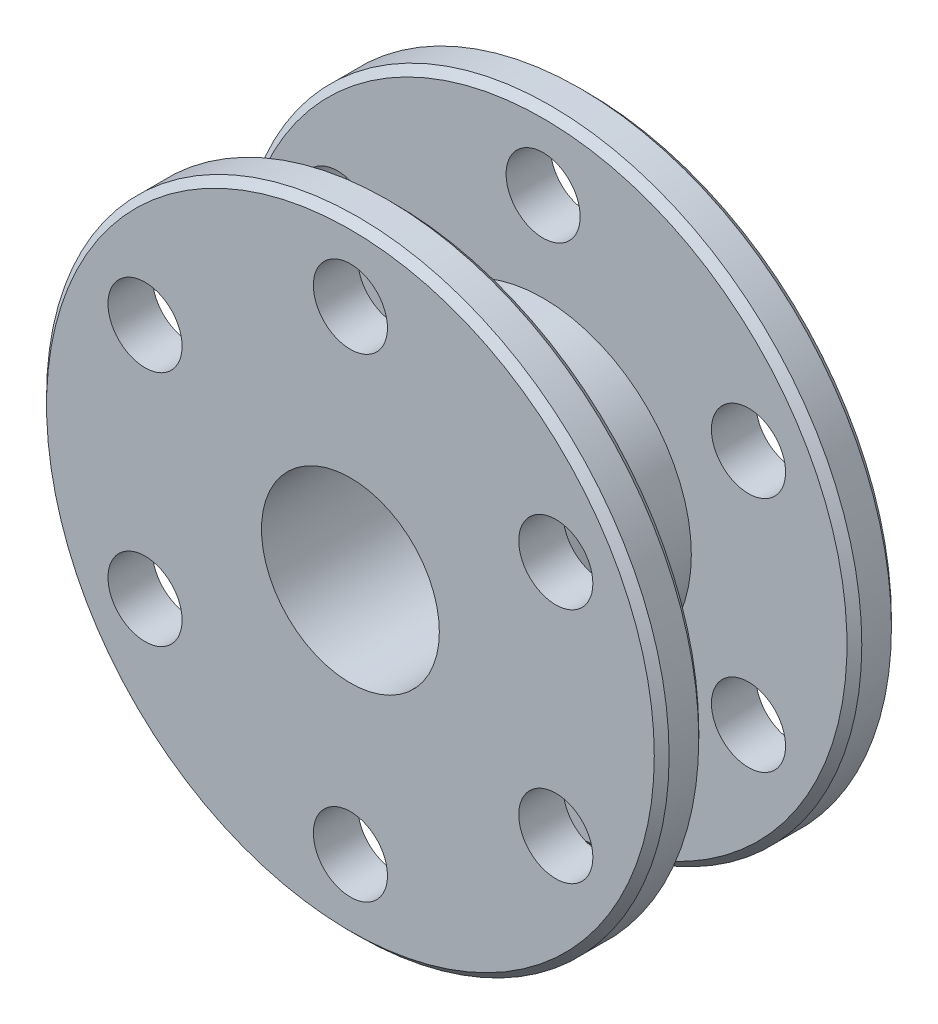
from build123d import *

# Parameters (mm, degrees)
SKETCH1_R           = 21
SKETCH1_R_2         = 6
SKETCH1_R_3         = 2.5
BOSS_EXTRUDE1_DEPTH = 16
SKETCH3_W           = 19.704974576
SKETCH3_H           = 10
CHAMFER1_SIZE       = 0.5


with BuildPart() as part:
    # Sketch1 → Boss-Extrude1 (new body)
    with BuildSketch(Plane.XY):
        Circle(SKETCH1_R)
        Circle(SKETCH1_R_2, mode=Mode.SUBTRACT)
        with Locations((0, 16)):
            Circle(SKETCH1_R_3, mode=Mode.SUBTRACT)
        with Locations((13.856406461, 8)):
            Circle(SKETCH1_R_3, mode=Mode.SUBTRACT)
        with Locations((13.856406461, -8)):
            Circle(SKETCH1_R_3, mode=Mode.SUBTRACT)
        with Locations((0, -16)):
            Circle(SKETCH1_R_3, mode=Mode.SUBTRACT)
        with Locations((-13.856406461, -8)):
            Circle(SKETCH1_R_3, mode=Mode.SUBTRACT)
        with Locations((-13.856406461, 8)):
            Circle(SKETCH1_R_3, mode=Mode.SUBTRACT)
    extrude(amount=BOSS_EXTRUDE1_DEPTH)

    # Sketch3 → Cut-Revolve1 (revolve, cut)
    with BuildSketch(Plane(origin=(0, 0, 0), x_dir=(1, 0, 0), z_dir=(0, 1, 0))):
        with Locations((19.852487288, -8)):
            Rectangle(SKETCH3_W, SKETCH3_H)
    revolve(axis=Axis((0, 0, 16), (0, 0, -1)), mode=Mode.SUBTRACT)

    # Chamfer1
    chamfer1_edges = [part.edges().sort_by_distance(p)[0] for p in [
        (-21, 0, 0),
        (-21, 0, 13),
        (-21, 0, 3),
        (-21, 0, 16),
    ]]
    chamfer(chamfer1_edges, length=CHAMFER1_SIZE)


solid = part.part
